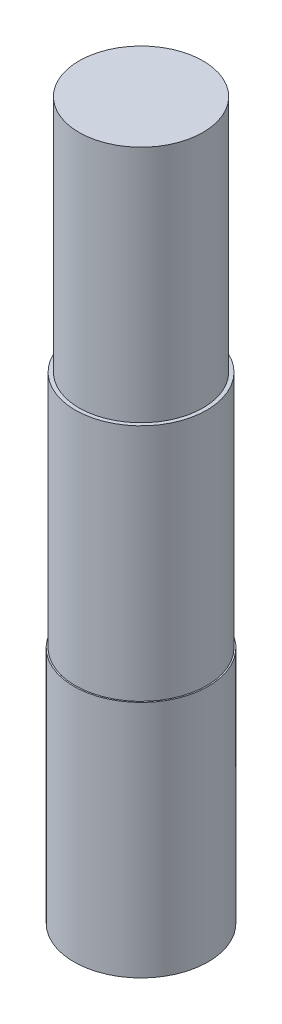
from build123d import *

# Parameters (mm, degrees)
SKETCH1_R           = 4.7625
BOSS_EXTRUDE1_DEPTH = 38.1
SKETCH2_R           = 5.832464333
SKETCH2_R_2         = 3.3
CUT_EXTRUDE1_DEPTH  = 12.7
SKETCH3_R           = 5.346562202
SKETCH3_R_2         = 3.5
CUT_EXTRUDE2_DEPTH  = 12.7
SKETCH4_R           = 4.91764208
SKETCH4_R_2         = 3.571875
CUT_EXTRUDE3_DEPTH  = 12.7


with BuildPart() as part:
    # Sketch1 → Boss-Extrude1 (new body)
    with BuildSketch(Plane(origin=(0, 0, 0), x_dir=(1, 0, 0), z_dir=(0, 1, 0))):
        with Locations(Location((0, 0, 0), (0, 0, 90))):
            Circle(SKETCH1_R)
    extrude(amount=BOSS_EXTRUDE1_DEPTH)

    # Sketch2 → Cut-Extrude1 (cut)
    with BuildSketch(Plane(origin=(0, 38.1, 0), x_dir=(1, 0, 0), z_dir=(0, 1, 0))):
        Circle(SKETCH2_R)
        with Locations(Location((0, 0, 0), (0, 0, 270))):
            Circle(SKETCH2_R_2, mode=Mode.SUBTRACT)
    extrude(amount=-CUT_EXTRUDE1_DEPTH, mode=Mode.SUBTRACT)

    # Sketch3 → Cut-Extrude2 (cut)
    with BuildSketch(Plane(origin=(0, 25.4, 0), x_dir=(1, 0, 0), z_dir=(0, 1, 0))):
        Circle(SKETCH3_R)
        with Locations(Location((0, 0, 0), (0, 0, 270))):
            Circle(SKETCH3_R_2, mode=Mode.SUBTRACT)
    extrude(amount=-CUT_EXTRUDE2_DEPTH, mode=Mode.SUBTRACT)

    # Sketch4 → Cut-Extrude3 (cut)
    with BuildSketch(Plane.XZ):
        Circle(SKETCH4_R)
        with Locations(Location((0, 0, 0), (0, 0, 270))):
            Circle(SKETCH4_R_2, mode=Mode.SUBTRACT)
    extrude(amount=-CUT_EXTRUDE3_DEPTH, mode=Mode.SUBTRACT)


solid = part.part
